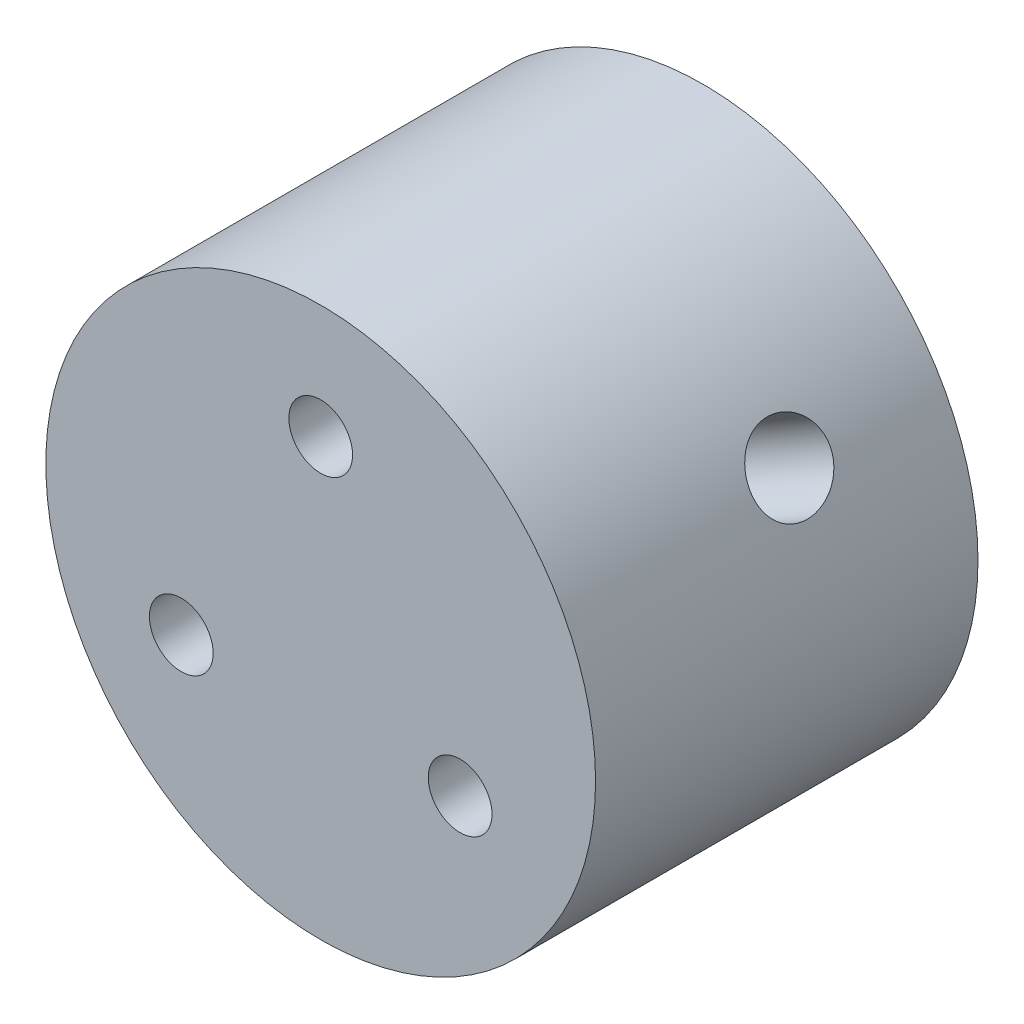
from build123d import *

# Parameters (mm, degrees)
SKICA1_R                 = 34.5
P_IDAT_VYSUNUT_M1_DEPTH  = 48
SKICA2_R                 = 4
ODEBRAT_VYSUNUT_M1_DEPTH = 40
SKICA3_R                 = 5
ODEBRAT_VYSUNUT_M2_DEPTH = 69.443407279
KRUHOV_POLE1_COUNT       = 3


with BuildPart() as part:
    # Skica1 → Přidat vysunutím1 (new body)
    with BuildSketch(Plane.XY):
        Circle(SKICA1_R)
    extrude(amount=P_IDAT_VYSUNUT_M1_DEPTH)

    # Skica2 → Odebrat vysunutím1 (cut)
    with BuildSketch(Plane.XY.offset(48)):
        with Locations((0, 20.207259422)):
            Circle(SKICA2_R)
        with Locations((17.5, -10.103629711)):
            Circle(SKICA2_R)
        with Locations((-17.5, -10.103629711)):
            Circle(SKICA2_R)
    extrude(amount=-ODEBRAT_VYSUNUT_M1_DEPTH, mode=Mode.SUBTRACT)

    # Skica3 → Odebrat vysunutím2 (cut, through all)
    with BuildSketch(Plane(origin=(0, 0, 0), x_dir=(1, 0, 0), z_dir=(0, 1, 0))):
        with Locations(Location((0, -19, 0), (0, 0, 270))):
            Circle(SKICA3_R)
    odebrat_vysunut_m2 = extrude(amount=-ODEBRAT_VYSUNUT_M2_DEPTH, mode=Mode.SUBTRACT)

    # Kruhové pole1: Odebrat vysunutím2 ×3 about axis
    kruhov_pole1_axis = Axis((0, 0, 48), (0, 0, -1))
    for i in range(1, KRUHOV_POLE1_COUNT):
        add(odebrat_vysunut_m2.rotate(kruhov_pole1_axis, i * 360 / KRUHOV_POLE1_COUNT), mode=Mode.SUBTRACT)


solid = part.part
